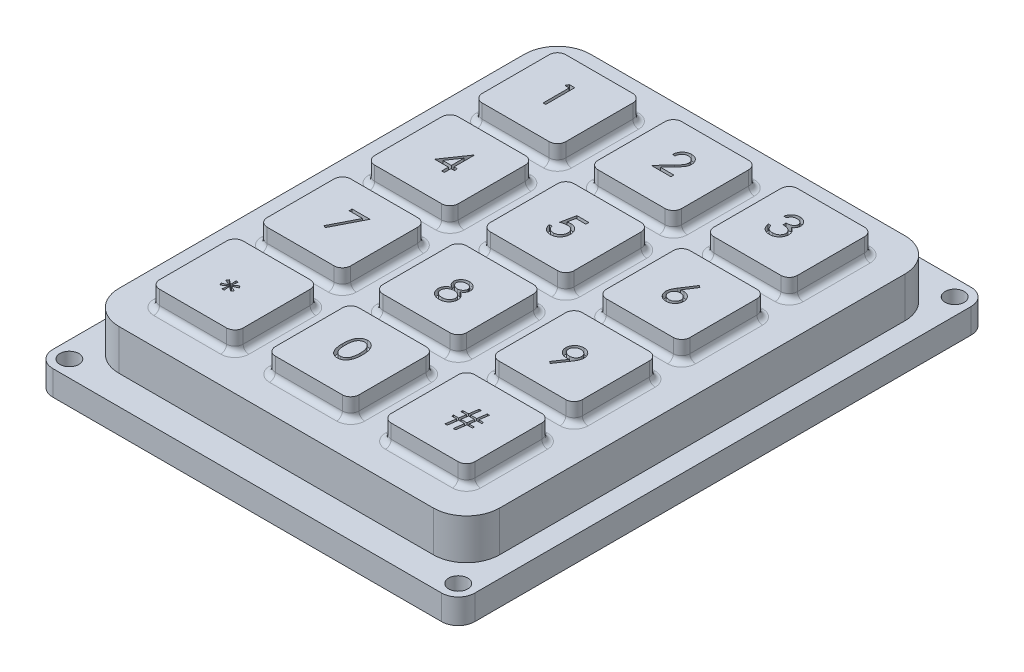
from build123d import *

# Parameters (mm, degrees)
BOSS_EXTRUDE1_DEPTH = 3
BOSS_EXTRUDE2_DEPTH = 4.9
SKETCH4_R           = 1.15
CUT_EXTRUDE1_DEPTH  = 42.209950255
BOSS_EXTRUDE4_DEPTH = 2.4
FILLET1_R           = 0.7
CUT_EXTRUDE2_DEPTH  = 42.563686073
FILLET2_R           = 2
CUT_EXTRUDE3_DEPTH  = 0.7


with BuildPart() as part:
    # Sketch1 → Boss-Extrude1 (new body)
    with BuildSketch(Plane(origin=(0, 0, 0), x_dir=(1, 0, 0), z_dir=(0, 1, 0))):
        with BuildLine():
            Line((23.5, -32), (-23.5, -32))
            ThreePointArc((-23.5, -32), (-24.914213562, -31.414213562), (-25.5, -30))
            Line((-25.5, -30), (-25.5, 30))
            ThreePointArc((-25.5, 30), (-24.914213562, 31.414213562), (-23.5, 32))
            Line((-23.5, 32), (23.5, 32))
            ThreePointArc((23.5, 32), (24.914213562, 31.414213562), (25.5, 30))
            Line((25.5, 30), (25.5, -30))
            ThreePointArc((25.5, -30), (24.914213562, -31.414213562), (23.5, -32))
        make_face()
    extrude(amount=BOSS_EXTRUDE1_DEPTH)

    # Sketch2 → Boss-Extrude2 (add)
    with BuildSketch(Plane(origin=(0, 3, 0), x_dir=(1, 0, 0), z_dir=(0, 1, 0))):
        with BuildLine():
            Line((-19, -28.5), (19, -28.5))
            ThreePointArc((19, -28.5), (21.828427125, -27.328427125), (23, -24.5))
            Line((23, -24.5), (23, 24.5))
            ThreePointArc((23, 24.5), (21.828427125, 27.328427125), (19, 28.5))
            Line((19, 28.5), (-19, 28.5))
            ThreePointArc((-19, 28.5), (-21.828427125, 27.328427125), (-23, 24.5))
            Line((-23, 24.5), (-23, -24.5))
            ThreePointArc((-23, -24.5), (-21.828427125, -27.328427125), (-19, -28.5))
        make_face()
    extrude(amount=BOSS_EXTRUDE2_DEPTH)

    # Sketch4 → Cut-Extrude1 (cut, through all)
    with BuildSketch(Plane(origin=(0, 3, 0), x_dir=(1, 0, 0), z_dir=(0, 1, 0))):
        with Locations(Location((-23.5, 30, 0), (0, 0, 270))):
            Circle(SKETCH4_R)
        with Locations(Location((-23.5, -30, 0), (0, 0, 90))):
            Circle(SKETCH4_R)
        with Locations(Location((23.5, -30, 0), (0, 0, 270))):
            Circle(SKETCH4_R)
        with Locations(Location((23.5, 30, 0), (0, 0, 90))):
            Circle(SKETCH4_R)
    extrude(amount=-CUT_EXTRUDE1_DEPTH, mode=Mode.SUBTRACT)

    # Sketch5 → Boss-Extrude4 (add)
    with BuildSketch(Plane(origin=(0, 7.9, 0), x_dir=(1, 0, 0), z_dir=(0, 1, 0))):
        with BuildLine():
            Line((-4.05, -24.55), (4.05, -24.55))
            ThreePointArc((4.05, -24.55), (4.757106781, -24.257106781), (5.05, -23.55))
            Line((5.05, -23.55), (5.05, -15.45))
            ThreePointArc((5.05, -15.45), (4.757106781, -14.742893219), (4.05, -14.45))
            Line((4.05, -14.45), (-4.05, -14.45))
            ThreePointArc((-4.05, -14.45), (-4.757106781, -14.742893219), (-5.05, -15.45))
            Line((-5.05, -15.45), (-5.05, -23.55))
            ThreePointArc((-5.05, -23.55), (-4.757106781, -24.257106781), (-4.05, -24.55))
        make_face()
        with BuildLine():
            Line((9.95, -24.55), (18.05, -24.55))
            ThreePointArc((18.05, -24.55), (18.757106781, -24.257106781), (19.05, -23.55))
            Line((19.05, -23.55), (19.05, -15.45))
            ThreePointArc((19.05, -15.45), (18.757106781, -14.742893219), (18.05, -14.45))
            Line((18.05, -14.45), (9.95, -14.45))
            ThreePointArc((9.95, -14.45), (9.242893219, -14.742893219), (8.95, -15.45))
            Line((8.95, -15.45), (8.95, -23.55))
            ThreePointArc((8.95, -23.55), (9.242893219, -24.257106781), (9.95, -24.55))
        make_face()
        with BuildLine():
            Line((-18.05, -24.55), (-9.95, -24.55))
            ThreePointArc((-9.95, -24.55), (-9.242893219, -24.257106781), (-8.95, -23.55))
            Line((-8.95, -23.55), (-8.95, -15.45))
            ThreePointArc((-8.95, -15.45), (-9.242893219, -14.742893219), (-9.95, -14.45))
            Line((-9.95, -14.45), (-18.05, -14.45))
            ThreePointArc((-18.05, -14.45), (-18.757106781, -14.742893219), (-19.05, -15.45))
            Line((-19.05, -15.45), (-19.05, -23.55))
            ThreePointArc((-19.05, -23.55), (-18.757106781, -24.257106781), (-18.05, -24.55))
        make_face()
        with BuildLine():
            Line((-4.05, -11.55), (4.05, -11.55))
            ThreePointArc((4.05, -11.55), (4.757106781, -11.257106781), (5.05, -10.55))
            Line((5.05, -10.55), (5.05, -2.45))
            ThreePointArc((5.05, -2.45), (4.757106781, -1.742893219), (4.05, -1.45))
            Line((4.05, -1.45), (-4.05, -1.45))
            ThreePointArc((-4.05, -1.45), (-4.757106781, -1.742893219), (-5.05, -2.45))
            Line((-5.05, -2.45), (-5.05, -10.55))
            ThreePointArc((-5.05, -10.55), (-4.757106781, -11.257106781), (-4.05, -11.55))
        make_face()
        with BuildLine():
            Line((9.95, -11.55), (18.05, -11.55))
            ThreePointArc((18.05, -11.55), (18.757106781, -11.257106781), (19.05, -10.55))
            Line((19.05, -10.55), (19.05, -2.45))
            ThreePointArc((19.05, -2.45), (18.757106781, -1.742893219), (18.05, -1.45))
            Line((18.05, -1.45), (9.95, -1.45))
            ThreePointArc((9.95, -1.45), (9.242893219, -1.742893219), (8.95, -2.45))
            Line((8.95, -2.45), (8.95, -10.55))
            ThreePointArc((8.95, -10.55), (9.242893219, -11.257106781), (9.95, -11.55))
        make_face()
        with BuildLine():
            Line((-18.05, -11.55), (-9.95, -11.55))
            ThreePointArc((-9.95, -11.55), (-9.242893219, -11.257106781), (-8.95, -10.55))
            Line((-8.95, -10.55), (-8.95, -2.45))
            ThreePointArc((-8.95, -2.45), (-9.242893219, -1.742893219), (-9.95, -1.45))
            Line((-9.95, -1.45), (-18.05, -1.45))
            ThreePointArc((-18.05, -1.45), (-18.757106781, -1.742893219), (-19.05, -2.45))
            Line((-19.05, -2.45), (-19.05, -10.55))
            ThreePointArc((-19.05, -10.55), (-18.757106781, -11.257106781), (-18.05, -11.55))
        make_face()
        with BuildLine():
            Line((-4.05, 1.45), (4.05, 1.45))
            ThreePointArc((4.05, 1.45), (4.757106781, 1.742893219), (5.05, 2.45))
            Line((5.05, 2.45), (5.05, 10.55))
            ThreePointArc((5.05, 10.55), (4.757106781, 11.257106781), (4.05, 11.55))
            Line((4.05, 11.55), (-4.05, 11.55))
            ThreePointArc((-4.05, 11.55), (-4.757106781, 11.257106781), (-5.05, 10.55))
            Line((-5.05, 10.55), (-5.05, 2.45))
            ThreePointArc((-5.05, 2.45), (-4.757106781, 1.742893219), (-4.05, 1.45))
        make_face()
        with BuildLine():
            Line((9.95, 1.45), (18.05, 1.45))
            ThreePointArc((18.05, 1.45), (18.757106781, 1.742893219), (19.05, 2.45))
            Line((19.05, 2.45), (19.05, 10.55))
            ThreePointArc((19.05, 10.55), (18.757106781, 11.257106781), (18.05, 11.55))
            Line((18.05, 11.55), (9.95, 11.55))
            ThreePointArc((9.95, 11.55), (9.242893219, 11.257106781), (8.95, 10.55))
            Line((8.95, 10.55), (8.95, 2.45))
            ThreePointArc((8.95, 2.45), (9.242893219, 1.742893219), (9.95, 1.45))
        make_face()
        with BuildLine():
            Line((-18.05, 1.45), (-9.95, 1.45))
            ThreePointArc((-9.95, 1.45), (-9.242893219, 1.742893219), (-8.95, 2.45))
            Line((-8.95, 2.45), (-8.95, 10.55))
            ThreePointArc((-8.95, 10.55), (-9.242893219, 11.257106781), (-9.95, 11.55))
            Line((-9.95, 11.55), (-18.05, 11.55))
            ThreePointArc((-18.05, 11.55), (-18.757106781, 11.257106781), (-19.05, 10.55))
            Line((-19.05, 10.55), (-19.05, 2.45))
            ThreePointArc((-19.05, 2.45), (-18.757106781, 1.742893219), (-18.05, 1.45))
        make_face()
        with BuildLine():
            Line((-4.05, 14.45), (4.05, 14.45))
            ThreePointArc((4.05, 14.45), (4.757106781, 14.742893219), (5.05, 15.45))
            Line((5.05, 15.45), (5.05, 23.55))
            ThreePointArc((5.05, 23.55), (4.757106781, 24.257106781), (4.05, 24.55))
            Line((4.05, 24.55), (-4.05, 24.55))
            ThreePointArc((-4.05, 24.55), (-4.757106781, 24.257106781), (-5.05, 23.55))
            Line((-5.05, 23.55), (-5.05, 15.45))
            ThreePointArc((-5.05, 15.45), (-4.757106781, 14.742893219), (-4.05, 14.45))
        make_face()
        with BuildLine():
            Line((9.95, 14.45), (18.05, 14.45))
            ThreePointArc((18.05, 14.45), (18.757106781, 14.742893219), (19.05, 15.45))
            Line((19.05, 15.45), (19.05, 23.55))
            ThreePointArc((19.05, 23.55), (18.757106781, 24.257106781), (18.05, 24.55))
            Line((18.05, 24.55), (9.95, 24.55))
            ThreePointArc((9.95, 24.55), (9.242893219, 24.257106781), (8.95, 23.55))
            Line((8.95, 23.55), (8.95, 15.45))
            ThreePointArc((8.95, 15.45), (9.242893219, 14.742893219), (9.95, 14.45))
        make_face()
        with BuildLine():
            Line((-18.05, 14.45), (-9.95, 14.45))
            ThreePointArc((-9.95, 14.45), (-9.242893219, 14.742893219), (-8.95, 15.45))
            Line((-8.95, 15.45), (-8.95, 23.55))
            ThreePointArc((-8.95, 23.55), (-9.242893219, 24.257106781), (-9.95, 24.55))
            Line((-9.95, 24.55), (-18.05, 24.55))
            ThreePointArc((-18.05, 24.55), (-18.757106781, 24.257106781), (-19.05, 23.55))
            Line((-19.05, 23.55), (-19.05, 15.45))
            ThreePointArc((-19.05, 15.45), (-18.757106781, 14.742893219), (-18.05, 14.45))
        make_face()
    extrude(amount=BOSS_EXTRUDE4_DEPTH)

    # Fillet1
    fillet1_edges = [part.edges().sort_by_distance(p)[0] for p in [
        (18.757106781, 7.9, 24.257106781),
        (19.05, 7.9, 19.5),
        (18.757106781, 7.9, 14.742893219),
        (14, 7.9, 14.45),
        (9.242893219, 7.9, 14.742893219),
        (8.95, 7.9, 19.5),
        (9.242893219, 7.9, 24.257106781),
        (14, 7.9, 24.55),
        (4.757106781, 7.9, 11.257106781),
        (5.05, 7.9, 6.5),
        (4.757106781, 7.9, 1.742893219),
        (0, 7.9, 1.45),
        (-4.757106781, 7.9, 1.742893219),
        (-5.05, 7.9, 6.5),
        (-4.757106781, 7.9, 11.257106781),
        (0, 7.9, 11.55),
        (-9.242893219, 7.9, 11.257106781),
        (-8.95, 7.9, 6.5),
        (-9.242893219, 7.9, 1.742893219),
        (-14, 7.9, 1.45),
        (-18.757106781, 7.9, 1.742893219),
        (-19.05, 7.9, 6.5),
        (-18.757106781, 7.9, 11.257106781),
        (-14, 7.9, 11.55),
        (18.757106781, 7.9, 11.257106781),
        (19.05, 7.9, 6.5),
        (18.757106781, 7.9, 1.742893219),
        (14, 7.9, 1.45),
        (9.242893219, 7.9, 1.742893219),
        (8.95, 7.9, 6.5),
        (9.242893219, 7.9, 11.257106781),
        (14, 7.9, 11.55),
        (4.757106781, 7.9, -1.742893219),
        (5.05, 7.9, -6.5),
        (4.757106781, 7.9, -11.257106781),
        (0, 7.9, -11.55),
        (-4.757106781, 7.9, -11.257106781),
        (-5.05, 7.9, -6.5),
        (-4.757106781, 7.9, -1.742893219),
        (0, 7.9, -1.45),
        (-9.242893219, 7.9, -1.742893219),
        (-8.95, 7.9, -6.5),
        (-9.242893219, 7.9, -11.257106781),
        (-14, 7.9, -11.55),
        (-18.757106781, 7.9, -11.257106781),
        (-19.05, 7.9, -6.5),
        (-18.757106781, 7.9, -1.742893219),
        (-14, 7.9, -1.45),
        (18.757106781, 7.9, -1.742893219),
        (19.05, 7.9, -6.5),
        (18.757106781, 7.9, -11.257106781),
        (14, 7.9, -11.55),
        (9.242893219, 7.9, -11.257106781),
        (8.95, 7.9, -6.5),
        (9.242893219, 7.9, -1.742893219),
        (14, 7.9, -1.45),
        (4.757106781, 7.9, -14.742893219),
        (5.05, 7.9, -19.5),
        (4.757106781, 7.9, -24.257106781),
        (0, 7.9, -24.55),
        (-4.757106781, 7.9, -24.257106781),
        (-5.05, 7.9, -19.5),
        (-4.757106781, 7.9, -14.742893219),
        (0, 7.9, -14.45),
        (-9.242893219, 7.9, -14.742893219),
        (-8.95, 7.9, -19.5),
        (-9.242893219, 7.9, -24.257106781),
        (-14, 7.9, -24.55),
        (-18.757106781, 7.9, -24.257106781),
        (-19.05, 7.9, -19.5),
        (-18.757106781, 7.9, -14.742893219),
        (-14, 7.9, -14.45),
        (18.757106781, 7.9, -14.742893219),
        (19.05, 7.9, -19.5),
        (18.757106781, 7.9, -24.257106781),
        (14, 7.9, -24.55),
        (9.242893219, 7.9, -24.257106781),
        (8.95, 7.9, -19.5),
        (9.242893219, 7.9, -14.742893219),
        (14, 7.9, -14.45),
        (4.757106781, 7.9, 24.257106781),
        (5.05, 7.9, 19.5),
        (4.757106781, 7.9, 14.742893219),
        (0, 7.9, 14.45),
        (-4.757106781, 7.9, 14.742893219),
        (-5.05, 7.9, 19.5),
        (-4.757106781, 7.9, 24.257106781),
        (0, 7.9, 24.55),
        (-9.242893219, 7.9, 24.257106781),
        (-8.95, 7.9, 19.5),
        (-9.242893219, 7.9, 14.742893219),
        (-14, 7.9, 14.45),
        (-18.757106781, 7.9, 14.742893219),
        (-19.05, 7.9, 19.5),
        (-18.757106781, 7.9, 24.257106781),
        (-14, 7.9, 24.55),
    ]]
    fillet(fillet1_edges, radius=FILLET1_R)

    # Sketch6 → Cut-Extrude2 (cut, through all)
    with BuildSketch(Plane(origin=(0, 3, 0), x_dir=(1, 0, 0), z_dir=(0, 1, 0))):
        Polygon((-3, 32), (-3, 28.820730597), (3, 28.820730597), (3, 32), (0, 37.955310805), align=None)
    extrude(amount=-CUT_EXTRUDE2_DEPTH, mode=Mode.SUBTRACT)

    # Fillet2
    fillet2_edges = [part.edges().sort_by_distance(p)[0] for p in [
        (3, 1.5, -28.820730597),
        (-3, 1.5, -28.820730597),
    ]]
    fillet(fillet2_edges, radius=FILLET2_R)

    # Sketch7 → Cut-Extrude3 (cut)
    # profile 1 of 12: a face of its own
    with BuildSketch(Plane(origin=(0, 10.3, 0), x_dir=(1, 0, 0), z_dir=(0, 1, 0))):
        Polygon((-14.700628475, 21.631365532), (-14.053493058, 21.631365532), (-14.053493058, 18.131365532), (-14.367595622, 18.131365532), (-14.367595622, 21.272391174), (-14.906057161, 21.272391174), align=None)
    # profile 2 of 12: a face of its own
    with BuildSketch(Plane(origin=(0, 10.3, 0), x_dir=(1, 0, 0), z_dir=(0, 1, 0))):
        with BuildLine():
            Line((-0.846543631, 20.554442456), (-1.160646195, 20.554442456))
            add(Edge.make_bspline(
                [(-1.160646195, 20.554442456), (-1.158599042, 20.596113343), (-1.154578488, 20.677953858), (-1.135750199, 20.797277764), (-1.108809321, 20.911332563), (-1.070717867, 21.019202477), (-1.02341159, 21.121841284), (-0.966681562, 21.2188413), (-0.899487712, 21.309832489), (-0.823280978, 21.393971332), (-0.740512339, 21.471158903), (-0.651206399, 21.537814146), (-0.557361372, 21.594131817), (-0.459261973, 21.641213059), (-0.355801409, 21.676552905), (-0.247918551, 21.702774544), (-0.135139415, 21.71855089), (-0.058299393, 21.720246676), (-0.019219913, 21.721109122)],
                knots=[0, 0, 0, 0, 1.10065271, 2.161652631, 3.183658789, 4.190468796, 5.17591951, 6.163126047, 7.15150782, 8.156236427, 9.156009102, 10.134482811, 11.092018607, 12.041330605, 13.001268258, 13.972401359, 14.968799086, 16, 16, 16, 16], degree=3))
            add(Edge.make_bspline(
                [(-0.019219913, 21.721109122), (0.019158161, 21.720210666), (0.094569706, 21.718445231), (0.20463172, 21.703284202), (0.309409015, 21.67953861), (0.408696781, 21.646223194), (0.501702846, 21.601438766), (0.58912589, 21.547641228), (0.672006701, 21.485421396), (0.746613485, 21.412167583), (0.815121564, 21.333965198), (0.874223819, 21.250477295), (0.924836983, 21.164248009), (0.967024663, 21.074619808), (0.998080802, 20.980748779), (1.02165901, 20.884001576), (1.034986423, 20.783376765), (1.037031847, 20.71527021), (1.038071754, 20.680644379)],
                knots=[0, 0, 0, 0, 1.111607364, 2.184268762, 3.212621178, 4.221274766, 5.211760367, 6.196651075, 7.1921475, 8.207485113, 9.220403448, 10.201281604, 11.166441695, 12.114753415, 13.065576456, 14.026450734, 14.996634279, 16, 16, 16, 16], degree=3))
            add(Edge.make_bspline(
                [(1.038071754, 20.680644379), (1.036378491, 20.631896544), (1.03302168, 20.53525633), (1.004307303, 20.393241468), (0.959460792, 20.255648049), (0.905463435, 20.144910746), (0.850990991, 20.055677253), (0.801903483, 19.982208548), (0.744438672, 19.903103079), (0.677760174, 19.818625742), (0.603247302, 19.728114837), (0.520225139, 19.631625042), (0.428101657, 19.530153272), (0.363443156, 19.46084767), (0.329938741, 19.424935244)],
                knots=[0, 0, 0, 0, 1.184426356, 2.348067706, 3.509069118, 4.696110526, 5.333549288, 6.050745305, 6.844228056, 7.710549037, 8.667450064, 9.695053472, 10.805634456, 12, 12, 12, 12], degree=3))
            Line((0.329938741, 19.424935244), (-0.545762381, 18.490339891))
            Line((-0.545762381, 18.490339891), (1.082943549, 18.490339891))
            Line((1.082943549, 18.490339891), (1.082943549, 18.131365532))
            Line((1.082943549, 18.131365532), (-1.295261579, 18.131365532))
            Line((-1.295261579, 18.131365532), (0.062110215, 19.579883161))
            add(Edge.make_bspline(
                [(0.062110215, 19.579883161), (0.095158102, 19.614381467), (0.158636329, 19.680645654), (0.248418906, 19.777388614), (0.329057894, 19.867138155), (0.401075287, 19.949724703), (0.462908793, 20.026356271), (0.517781025, 20.094550975), (0.561746616, 20.157305425), (0.609462011, 20.230046039), (0.655675993, 20.318858356), (0.695388349, 20.427392045), (0.719603197, 20.539119298), (0.722508033, 20.614621335), (0.72396919, 20.652599507)],
                knots=[0, 0, 0, 0, 1.329631726, 2.553950428, 3.673215718, 4.687767853, 5.603093632, 6.413772471, 7.123043292, 7.734684054, 8.834405432, 9.900288307, 10.943827018, 12, 12, 12, 12], degree=3))
            add(Edge.make_bspline(
                [(0.72396919, 20.652599507), (0.723333447, 20.676480905), (0.722080521, 20.723546556), (0.711022824, 20.792552315), (0.694312318, 20.859117128), (0.67036706, 20.923445748), (0.63876032, 20.9848914), (0.60028694, 21.04352888), (0.555896876, 21.100217845), (0.504545607, 21.153371143), (0.448134087, 21.202052349), (0.388539838, 21.245176434), (0.325489733, 21.281215545), (0.259249611, 21.310759042), (0.190004142, 21.333934423), (0.117619397, 21.349993003), (0.04229538, 21.360075487), (-0.009138115, 21.361439658), (-0.035345714, 21.362134763)],
                knots=[0, 0, 0, 0, 0.991446411, 1.95395049, 2.89581595, 3.838931463, 4.798493298, 5.75982156, 6.748411868, 7.785213223, 8.824556874, 9.840280684, 10.836137867, 11.835679398, 12.848801643, 13.863922112, 14.911575587, 16, 16, 16, 16], degree=3))
            add(Edge.make_bspline(
                [(-0.035345714, 21.362134763), (-0.062716547, 21.361419731), (-0.116468343, 21.360015526), (-0.195387376, 21.350192862), (-0.270673154, 21.333247021), (-0.342515056, 21.310070347), (-0.411034642, 21.280611798), (-0.475898686, 21.243920053), (-0.536961576, 21.20013656), (-0.594338099, 21.150496004), (-0.647202078, 21.095228403), (-0.693648954, 21.03361844), (-0.734232968, 20.966791024), (-0.769642201, 20.894926474), (-0.798397892, 20.817372694), (-0.820371042, 20.734404989), (-0.837757889, 20.646383607), (-0.843566409, 20.585598523), (-0.846543631, 20.554442456)],
                knots=[0, 0, 0, 0, 1.031018746, 2.02475058, 2.990194455, 3.934040569, 4.864654155, 5.795059489, 6.735614925, 7.690564532, 8.649604399, 9.611025574, 10.590972636, 11.591080095, 12.624614302, 13.701020113, 14.821632451, 16, 16, 16, 16], degree=3))
        make_face()
    # profile 3 of 12: a face of its own
    with BuildSketch(Plane(origin=(0, 10.3, 0), x_dir=(1, 0, 0), z_dir=(0, 1, 0))):
        with BuildLine():
            Line((12.346677857, 20.823673225), (12.032575293, 20.823673225))
            add(Edge.make_bspline(
                [(12.032575293, 20.823673225), (12.041084844, 20.858905709), (12.057720319, 20.927782333), (12.092417893, 21.026189594), (12.130217148, 21.119313115), (12.175606252, 21.205409189), (12.225115007, 21.286208092), (12.281837728, 21.359877216), (12.343157451, 21.428290182), (12.4109824, 21.489003419), (12.482111062, 21.543981149), (12.557545681, 21.590856206), (12.635768575, 21.631180359), (12.717321708, 21.664400591), (12.80244788, 21.689426114), (12.890377503, 21.70758292), (12.981341003, 21.719374034), (13.043088594, 21.720524797), (13.07444228, 21.721109122)],
                knots=[0, 0, 0, 0, 1.162005537, 2.271625781, 3.343758855, 4.383309926, 5.390229558, 6.379919256, 7.361854164, 8.333198761, 9.295911338, 10.242430842, 11.177959212, 12.116337295, 13.062827104, 14.020064771, 14.994644689, 16, 16, 16, 16], degree=3))
            add(Edge.make_bspline(
                [(13.07444228, 21.721109122), (13.120125022, 21.719729892), (13.210494033, 21.717001517), (13.34325708, 21.69208708), (13.471283899, 21.652661948), (13.593173147, 21.598188221), (13.70639158, 21.531000907), (13.807127766, 21.45103617), (13.894016277, 21.359836869), (13.966910655, 21.259104305), (14.023985654, 21.151448795), (14.066072027, 21.040648638), (14.091693708, 20.926966667), (14.095014265, 20.850209388), (14.096677857, 20.811754154)],
                knots=[0, 0, 0, 0, 1.083050992, 2.142477498, 3.193116406, 4.255571735, 5.30263384, 6.308962982, 7.297363603, 8.282367274, 9.249857812, 10.179914175, 11.08814088, 12, 12, 12, 12], degree=3))
            add(Edge.make_bspline(
                [(14.096677857, 20.811754154), (14.095514266, 20.77474736), (14.093237299, 20.702330805), (14.073903593, 20.596609308), (14.04136733, 20.496967708), (13.996297568, 20.402986546), (13.937956018, 20.315261706), (13.867283321, 20.233595815), (13.783780659, 20.157626657), (13.720501721, 20.114107184), (13.687923851, 20.091702071)],
                knots=[0, 0, 0, 0, 1.024540389, 2.004866551, 2.965041327, 3.920577974, 4.882998113, 5.874504559, 6.905732034, 8, 8, 8, 8], degree=3))
            add(Edge.make_bspline(
                [(13.687923851, 20.091702071), (13.725155605, 20.073723899), (13.798922479, 20.038103942), (13.899473009, 19.968248184), (13.990750884, 19.887591837), (14.041654603, 19.824649184), (14.067230742, 19.793024186)],
                knots=[0, 0, 0, 0, 1.015518401, 2.012035669, 3.001164323, 4, 4, 4, 4], degree=3))
            add(Edge.make_bspline(
                [(14.067230742, 19.793024186), (14.084072084, 19.769966435), (14.11747898, 19.724228518), (14.158714514, 19.650692092), (14.196123628, 19.576340603), (14.225273847, 19.499181197), (14.247847714, 19.420108183), (14.263983746, 19.338985787), (14.274007887, 19.255747765), (14.275443439, 19.199435285), (14.276165036, 19.171129154)],
                knots=[0, 0, 0, 0, 1.025084078, 2.033381695, 3.024893161, 4.013698104, 4.991890475, 5.976764909, 6.982997093, 8, 8, 8, 8], degree=3))
            add(Edge.make_bspline(
                [(14.276165036, 19.171129154), (14.274370523, 19.122119433), (14.270789941, 19.024330631), (14.238785867, 18.87985591), (14.189172626, 18.738630407), (14.11871569, 18.603555568), (14.032848181, 18.477175187), (13.930690857, 18.364098878), (13.813404449, 18.266900274), (13.6825988, 18.185690046), (13.540881671, 18.120772123), (13.389306079, 18.075714681), (13.230056025, 18.046368681), (13.120848728, 18.043221812), (13.065327697, 18.041621943)],
                knots=[0, 0, 0, 0, 0.955779014, 1.907060117, 2.875433937, 3.871313158, 4.872415639, 5.851225146, 6.836215519, 7.83643374, 8.849228613, 9.86973379, 10.916971861, 12, 12, 12, 12], degree=3))
            add(Edge.make_bspline(
                [(13.065327697, 18.041621943), (13.027908396, 18.042490156), (12.954279691, 18.04419851), (12.846036193, 18.055877111), (12.742714494, 18.077207117), (12.644174896, 18.105910422), (12.550329859, 18.142302164), (12.461465754, 18.187620862), (12.377035861, 18.240932364), (12.29783691, 18.302865952), (12.223878342, 18.372147292), (12.157125618, 18.450006302), (12.096465825, 18.535003706), (12.043523186, 18.628126762), (11.995886233, 18.728172019), (11.956705277, 18.836420517), (11.922219708, 18.951904539), (11.906186244, 19.03238228), (11.897959908, 19.073673225)],
                knots=[0, 0, 0, 0, 1.048658725, 2.063410685, 3.046034179, 4.001477787, 4.936774919, 5.862367409, 6.792675028, 7.730719943, 8.675894397, 9.627829632, 10.600096036, 11.597688215, 12.626045268, 13.701542398, 14.82072376, 16, 16, 16, 16], degree=3))
            Line((11.897959908, 19.073673225), (12.212062472, 19.073673225))
            add(Edge.make_bspline(
                [(12.212062472, 19.073673225), (12.220245764, 19.046724212), (12.236162976, 18.99430604), (12.263257275, 18.918865734), (12.294125547, 18.849707681), (12.327240105, 18.786324559), (12.362018551, 18.728092157), (12.400933476, 18.676550288), (12.441102622, 18.629435085), (12.471381975, 18.602890473), (12.486201094, 18.589899186)],
                knots=[0, 0, 0, 0, 1.198163088, 2.33053128, 3.407730985, 4.417276592, 5.372219308, 6.28897303, 7.162600585, 8, 8, 8, 8], degree=3))
            add(Edge.make_bspline(
                [(12.486201094, 18.589899186), (12.505797671, 18.574790852), (12.544930334, 18.544620821), (12.608698565, 18.506119192), (12.675763451, 18.472758167), (12.747578125, 18.447274471), (12.822592895, 18.42569681), (12.902020261, 18.411576291), (12.985159478, 18.40188812), (13.041927241, 18.401033188), (13.070936671, 18.400596302)],
                knots=[0, 0, 0, 0, 0.946170439, 1.889420265, 2.845303464, 3.807233317, 4.801018734, 5.828864929, 6.890507805, 8, 8, 8, 8], degree=3))
            add(Edge.make_bspline(
                [(13.070936671, 18.400596302), (13.103690174, 18.401212207), (13.167736821, 18.402416557), (13.26119168, 18.413492263), (13.350099128, 18.429622677), (13.433472053, 18.45453566), (13.512402561, 18.485316511), (13.58578421, 18.523964917), (13.654580316, 18.569309638), (13.717909722, 18.620848797), (13.774855229, 18.677270292), (13.824994743, 18.736283363), (13.867619404, 18.797639193), (13.902002982, 18.861677313), (13.929153533, 18.928132542), (13.947636733, 18.997191372), (13.960488248, 19.068288638), (13.961534861, 19.116617607), (13.962062472, 19.140980917)],
                knots=[0, 0, 0, 0, 1.217147791, 2.380027433, 3.494444702, 4.572153297, 5.609568379, 6.639424714, 7.649109417, 8.668170816, 9.669597737, 10.625200337, 11.543417969, 12.441394052, 13.322311151, 14.205496177, 15.095365482, 16, 16, 16, 16], degree=3))
            add(Edge.make_bspline(
                [(13.962062472, 19.140980917), (13.960532171, 19.173592256), (13.957479182, 19.238652664), (13.934170603, 19.334370239), (13.895831739, 19.426593651), (13.842159227, 19.513749441), (13.776823499, 19.594525343), (13.700458592, 19.666596825), (13.612430364, 19.726066916), (13.531410494, 19.767155572), (13.459645338, 19.795192648), (13.398229954, 19.813867612), (13.32947335, 19.829681268), (13.254207001, 19.844393539), (13.171863785, 19.856914887), (13.082533347, 19.867356703), (12.986197585, 19.875711744), (12.919506419, 19.879442839), (12.885139395, 19.881365532)],
                knots=[0, 0, 0, 0, 1.07054697, 2.135767047, 3.216561865, 4.33974944, 5.486079747, 6.621378074, 7.775625952, 8.963672916, 9.598146892, 10.304877434, 11.070270905, 11.915000392, 12.823868403, 13.805723172, 14.86925407, 16, 16, 16, 16], degree=3))
            Line((12.885139395, 19.881365532), (12.885139395, 20.240339891))
            add(Edge.make_bspline(
                [(12.885139395, 20.240339891), (12.928440561, 20.241074695), (13.013256908, 20.242513995), (13.137151212, 20.259922006), (13.255624525, 20.284002634), (13.366051267, 20.320887826), (13.46669998, 20.363728123), (13.554019582, 20.413580332), (13.626786729, 20.468995082), (13.684647801, 20.530827691), (13.728177029, 20.597142738), (13.760003827, 20.666259396), (13.778804153, 20.738783457), (13.78131382, 20.788278125), (13.782575293, 20.813156398)],
                knots=[0, 0, 0, 0, 1.321986639, 2.589447074, 3.816329219, 5.01088745, 6.139805852, 7.153945165, 8.075214402, 8.924034688, 9.728124013, 10.488707548, 11.240355623, 12, 12, 12, 12], degree=3))
            add(Edge.make_bspline(
                [(13.782575293, 20.813156398), (13.782160882, 20.831434143), (13.781336431, 20.86779685), (13.770939153, 20.920921919), (13.755315112, 20.972422865), (13.733835383, 21.022080675), (13.705085184, 21.069550949), (13.670679198, 21.115238398), (13.629711097, 21.158882177), (13.58276565, 21.199562496), (13.532353845, 21.238331734), (13.47710407, 21.271245371), (13.418682196, 21.299390433), (13.357023541, 21.322599935), (13.29192801, 21.340059223), (13.223701453, 21.352595064), (13.152213769, 21.360432719), (13.103442037, 21.361561135), (13.078649011, 21.362134763)],
                knots=[0, 0, 0, 0, 0.884392785, 1.759457502, 2.611959086, 3.489218968, 4.37281399, 5.2945488, 6.255912374, 7.266815255, 8.301784654, 9.332968512, 10.37626691, 11.440494194, 12.520033166, 13.637162961, 14.798855837, 16, 16, 16, 16], degree=3))
            add(Edge.make_bspline(
                [(13.078649011, 21.362134763), (13.038797343, 21.360743401), (12.960957766, 21.358025748), (12.84874285, 21.334222734), (12.744423516, 21.296244651), (12.664684849, 21.250911631), (12.605802275, 21.206161197), (12.563725337, 21.167078811), (12.522404826, 21.123645987), (12.484559149, 21.073187612), (12.446285173, 21.019120822), (12.411440611, 20.95869714), (12.377580919, 20.893492746), (12.357178369, 20.847397112), (12.346677857, 20.823673225)],
                knots=[0, 0, 0, 0, 1.472543308, 2.876219568, 4.221790263, 5.565193594, 6.249813518, 6.953379497, 7.687249741, 8.463570142, 9.283606569, 10.136032583, 11.040678096, 12, 12, 12, 12], degree=3))
        make_face()
    # profile 4 of 12: a face of its own
    with BuildSketch(Plane(origin=(0, 10.3, 0), x_dir=(1, 0, 0), z_dir=(0, 1, 0))):
        Polygon((-13.1244245, 8.472003828), (-13.060622417, 8.472003828), (-13.060622417, 6.048926905), (-12.656776263, 6.048926905), (-12.656776263, 5.689952546), (-13.060622417, 5.689952546), (-13.060622417, 4.882260238), (-13.374724981, 4.882260238), (-13.374724981, 5.689952546), (-15.034981391, 5.689952546), align=None)
        Polygon((-13.374724981, 6.048926905), (-13.374724981, 7.568958956), (-14.417994212, 6.048926905), align=None, mode=Mode.SUBTRACT)
    # profile 5 of 12: a face of its own
    with BuildSketch(Plane(origin=(0, 10.3, 0), x_dir=(1, 0, 0), z_dir=(0, 1, 0))):
        with BuildLine():
            Line((0.903456369, 8.382260238), (0.903456369, 8.023285879))
            Line((0.903456369, 8.023285879), (-0.287048438, 8.023285879))
            Line((-0.287048438, 8.023285879), (-0.475650201, 7.102712963))
            add(Edge.make_bspline(
                [(-0.475650201, 7.102712963), (-0.438594327, 7.112943235), (-0.366804431, 7.132762768), (-0.26084457, 7.154768539), (-0.160252367, 7.168033983), (-0.094976996, 7.169845293), (-0.063390586, 7.170721777)],
                knots=[0, 0, 0, 0, 1.100273476, 2.13160584, 3.095893838, 4, 4, 4, 4], degree=3))
            add(Edge.make_bspline(
                [(-0.063390586, 7.170721777), (-0.024306846, 7.169875841), (0.052541551, 7.16821252), (0.164980498, 7.152240671), (0.272313391, 7.127100756), (0.374315762, 7.091980234), (0.471176312, 7.047070501), (0.562003874, 6.990970561), (0.648161787, 6.92543723), (0.728104381, 6.850092218), (0.800628689, 6.767170601), (0.864394678, 6.67801273), (0.918557269, 6.583485068), (0.962118024, 6.482684459), (0.996902358, 6.376725306), (1.020054353, 6.264492723), (1.035471062, 6.147044603), (1.037193448, 6.066740033), (1.038071754, 6.025789886)],
                knots=[0, 0, 0, 0, 1.052922333, 2.070308379, 3.05430497, 4.020497103, 4.973039431, 5.925935799, 6.892292201, 7.88610001, 8.88166317, 9.857072816, 10.836096531, 11.812156883, 12.81219415, 13.836441305, 14.89672472, 16, 16, 16, 16], degree=3))
            add(Edge.make_bspline(
                [(1.038071754, 6.025789886), (1.037406679, 5.997267665), (1.036085516, 5.940608678), (1.029366928, 5.856464477), (1.016431212, 5.774101644), (0.999063488, 5.693509252), (0.97652107, 5.61483988), (0.949232016, 5.537868352), (0.915835989, 5.463073745), (0.879204613, 5.38974835), (0.837958135, 5.319549843), (0.792179628, 5.253900857), (0.743814137, 5.191816575), (0.691772751, 5.133962842), (0.635571756, 5.080719824), (0.575891789, 5.031771543), (0.51320907, 4.986290212), (0.446553828, 4.946122017), (0.377411345, 4.909159061), (0.304783128, 4.878835524), (0.230322428, 4.851724996), (0.152957552, 4.830115468), (0.072863739, 4.813182914), (-0.010091036, 4.801682313), (-0.095471706, 4.793305875), (-0.153346719, 4.792781519), (-0.182581291, 4.792516649)],
                knots=[0, 0, 0, 0, 1.056347294, 2.098418968, 3.122841568, 4.141288669, 5.149314143, 6.15115421, 7.162517403, 8.180376062, 9.185164535, 10.17417709, 11.141909838, 12.097768115, 13.052685741, 14.0056014, 14.954263652, 15.917497458, 16.885230207, 17.854509472, 18.828990115, 19.81800267, 20.826176721, 21.857883937, 22.917946725, 24, 24, 24, 24], degree=3))
            add(Edge.make_bspline(
                [(-0.182581291, 4.792516649), (-0.217455472, 4.793207487), (-0.286066302, 4.794566629), (-0.386586869, 4.808785114), (-0.483301475, 4.82914903), (-0.575431576, 4.8597853), (-0.66380284, 4.898172595), (-0.747225558, 4.946688766), (-0.827831334, 5.00166787), (-0.902343371, 5.066548223), (-0.971499484, 5.137463905), (-1.033405993, 5.214421546), (-1.08853957, 5.296150988), (-1.136017317, 5.383049142), (-1.176515338, 5.474887673), (-1.208330326, 5.572010674), (-1.234008681, 5.673910678), (-1.244872102, 5.744064189), (-1.250389785, 5.779696136)],
                knots=[0, 0, 0, 0, 1.0467383, 2.05933395, 3.04377827, 4.011590433, 4.970194871, 5.932262533, 6.905835911, 7.896367577, 8.894135286, 9.877477877, 10.858688626, 11.851381753, 12.8477658, 13.868841284, 14.917554742, 16, 16, 16, 16], degree=3))
            Line((-1.250389785, 5.779696136), (-0.936287221, 5.779696136))
            add(Edge.make_bspline(
                [(-0.936287221, 5.779696136), (-0.928558663, 5.746319683), (-0.913703947, 5.682168288), (-0.881098198, 5.592036947), (-0.841232322, 5.511717723), (-0.793827974, 5.44014814), (-0.737277944, 5.377739143), (-0.672748515, 5.322122081), (-0.600400791, 5.271946952), (-0.520007562, 5.230124184), (-0.435194483, 5.194455431), (-0.346427273, 5.170703736), (-0.256122926, 5.154002843), (-0.195044556, 5.152331082), (-0.164352124, 5.151491008)],
                knots=[0, 0, 0, 0, 1.136247022, 2.183929868, 3.172523383, 4.106158343, 5.02341133, 5.958108904, 6.928429099, 7.938127109, 8.96079061, 9.975095812, 10.982467395, 12, 12, 12, 12], degree=3))
            add(Edge.make_bspline(
                [(-0.164352124, 5.151491008), (-0.13439368, 5.152311785), (-0.075405258, 5.153927904), (0.011406129, 5.166366916), (0.095219003, 5.185524487), (0.17520636, 5.214194342), (0.252767899, 5.249039061), (0.32594167, 5.293754137), (0.396844547, 5.345214155), (0.463272681, 5.404170785), (0.52411213, 5.46914048), (0.577868251, 5.538617873), (0.622645164, 5.61273472), (0.660379273, 5.690207872), (0.689032572, 5.77188643), (0.709473553, 5.857387605), (0.721476612, 5.946922585), (0.723127792, 6.007991895), (0.72396919, 6.0391112)],
                knots=[0, 0, 0, 0, 1.027316725, 2.022795036, 3.002884548, 3.971462791, 4.93288096, 5.914575861, 6.907176829, 7.935150275, 8.956128384, 9.956726525, 10.942570165, 11.921478529, 12.907843606, 13.90538589, 14.932640048, 16, 16, 16, 16], degree=3))
            add(Edge.make_bspline(
                [(0.72396919, 6.0391112), (0.72331071, 6.067186952), (0.72202183, 6.122141241), (0.71149126, 6.202540447), (0.693174288, 6.278613489), (0.667750408, 6.350727723), (0.6354709, 6.418951166), (0.596024588, 6.483354226), (0.54867119, 6.543088059), (0.494579301, 6.598180613), (0.43532126, 6.649025488), (0.369877518, 6.692369574), (0.299617591, 6.728833492), (0.225387991, 6.76030149), (0.145423093, 6.782902235), (0.06130646, 6.799870121), (-0.027870247, 6.809685483), (-0.088840936, 6.811047372), (-0.120181451, 6.811747418)],
                knots=[0, 0, 0, 0, 1.045622112, 2.046656509, 3.013763289, 3.955457236, 4.890082067, 5.820317437, 6.762574623, 7.722996705, 8.69280354, 9.665887285, 10.63943826, 11.638615906, 12.663482002, 13.728887084, 14.832589034, 16, 16, 16, 16], degree=3))
            add(Edge.make_bspline(
                [(-0.120181451, 6.811747418), (-0.14731038, 6.811166827), (-0.203324735, 6.809968053), (-0.289247562, 6.801141556), (-0.379539285, 6.786902262), (-0.473853781, 6.767316015), (-0.572474289, 6.741684938), (-0.67519269, 6.710970437), (-0.782224956, 6.674248438), (-0.85434268, 6.646516225), (-0.891415426, 6.632260238)],
                knots=[0, 0, 0, 0, 0.817624296, 1.688186739, 2.600797293, 3.572016777, 4.590301741, 5.671205678, 6.80286297, 8, 8, 8, 8], degree=3))
            Line((-0.891415426, 6.632260238), (-0.532441067, 8.382260238))
            Line((-0.532441067, 8.382260238), (0.903456369, 8.382260238))
        make_face()
    # profile 6 of 12: a face of its own
    with BuildSketch(Plane(origin=(0, 10.3, 0), x_dir=(1, 0, 0), z_dir=(0, 1, 0))):
        with BuildLine():
            Line((14.184095718, 8.472003828), (14.425982737, 8.281999822))
            Line((14.425982737, 8.281999822), (13.50120309, 6.867837161))
            add(Edge.make_bspline(
                [(13.50120309, 6.867837161), (13.562773367, 6.877651022), (13.682873153, 6.896794067), (13.804439052, 6.899952012), (13.863683058, 6.901491008)],
                knots=[0, 0, 0, 0, 1.025318673, 2, 2, 2, 2], degree=3))
            add(Edge.make_bspline(
                [(13.863683058, 6.901491008), (13.899255554, 6.900534896), (13.969278954, 6.898652818), (14.072085757, 6.884168968), (14.170874693, 6.861343856), (14.265236305, 6.8280716), (14.355509287, 6.785569246), (14.442211683, 6.734630375), (14.523713693, 6.672624695), (14.601064872, 6.603359739), (14.67129197, 6.526642755), (14.733468025, 6.445241418), (14.785694817, 6.359240537), (14.828068738, 6.268683671), (14.860973617, 6.173710411), (14.884961262, 6.074442272), (14.899140855, 5.9708108), (14.901066346, 5.900332625), (14.902044436, 5.864531873)],
                knots=[0, 0, 0, 0, 1.04369286, 2.054478336, 3.041073146, 4.015093852, 4.984733326, 5.965804835, 6.960378782, 7.985147595, 9.009457201, 10.008161701, 10.986880575, 11.956520048, 12.937015923, 13.931873656, 14.949455224, 16, 16, 16, 16], degree=3))
            add(Edge.make_bspline(
                [(14.902044436, 5.864531873), (14.900621331, 5.815552169), (14.897820997, 5.719171703), (14.869917201, 5.578794997), (14.826557557, 5.445062481), (14.764580028, 5.32010931), (14.687597645, 5.20410674), (14.593720053, 5.101321275), (14.486276564, 5.009651237), (14.364789766, 4.932994618), (14.234046802, 4.870391567), (14.096694804, 4.825426325), (13.954067658, 4.797742856), (13.85726305, 4.794272253), (13.808294436, 4.792516649)],
                knots=[0, 0, 0, 0, 1.031375318, 2.029502543, 3.004789286, 3.987476834, 4.960371455, 5.9300674, 6.912260825, 7.929083631, 8.949397511, 9.960523116, 10.96833055, 12, 12, 12, 12], degree=3))
            add(Edge.make_bspline(
                [(13.808294436, 4.792516649), (13.761197735, 4.794044854), (13.667907417, 4.797071962), (13.530674623, 4.8240379), (13.398811606, 4.867745003), (13.273242225, 4.927959282), (13.156921612, 5.004017164), (13.052855975, 5.095579444), (12.961564201, 5.200688909), (12.88558958, 5.319329256), (12.825330848, 5.446819213), (12.780140923, 5.57975637), (12.75374468, 5.717656352), (12.750056123, 5.811137491), (12.748198282, 5.858221777)],
                knots=[0, 0, 0, 0, 1.012016664, 2.004627821, 2.994792927, 3.992885782, 4.990978636, 5.973936114, 6.964471063, 7.975201453, 8.993600317, 9.990122807, 10.98767138, 12, 12, 12, 12], degree=3))
            add(Edge.make_bspline(
                [(12.748198282, 5.858221777), (12.749379727, 5.89426636), (12.751792012, 5.967862512), (12.768635402, 6.07932654), (12.795700197, 6.193377622), (12.826010443, 6.290131815), (12.858036054, 6.369393337), (12.884688593, 6.433296828), (12.917862589, 6.499057901), (12.95323597, 6.568931537), (12.993992839, 6.64111697), (13.038308489, 6.716820639), (13.08740814, 6.794838567), (13.121828302, 6.847782762), (13.139424244, 6.874848379)],
                knots=[0, 0, 0, 0, 1.173818275, 2.396712641, 3.66331629, 4.989737886, 5.693666774, 6.447286557, 7.243889047, 8.091586357, 8.998013824, 9.943181721, 10.948533338, 12, 12, 12, 12], degree=3))
            Line((13.139424244, 6.874848379), (14.184095718, 8.472003828))
        make_face()
        with BuildLine():
            add(Edge.make_bspline(
                [(13.797777609, 6.542516649), (13.771115364, 6.541738605), (13.719036255, 6.54021886), (13.64262884, 6.531393608), (13.570315589, 6.514774542), (13.501138455, 6.49360821), (13.436390752, 6.46450515), (13.375601912, 6.429153351), (13.31853686, 6.387532173), (13.265793309, 6.340231262), (13.217973645, 6.288443229), (13.176792514, 6.232973707), (13.141270114, 6.175159504), (13.112388295, 6.114517562), (13.08989822, 6.051071062), (13.073629969, 5.985111813), (13.064576218, 5.916197507), (13.063069986, 5.869465004), (13.062300846, 5.845601585)],
                knots=[0, 0, 0, 0, 1.129588631, 2.206414736, 3.251139165, 4.268635594, 5.265702196, 6.250456724, 7.242448911, 8.251968645, 9.246821453, 10.222880186, 11.173611482, 12.116736599, 13.062300278, 14.020270554, 14.989073742, 16, 16, 16, 16], degree=3))
            add(Edge.make_bspline(
                [(13.062300846, 5.845601585), (13.062927208, 5.821951605), (13.064155409, 5.775577515), (13.075307729, 5.707238335), (13.092342811, 5.641473427), (13.117683207, 5.578621828), (13.147910095, 5.51772551), (13.18781542, 5.460990225), (13.232032205, 5.404970155), (13.284886139, 5.353968683), (13.341609502, 5.306512059), (13.402210704, 5.265031805), (13.465370664, 5.229545632), (13.531942086, 5.201734534), (13.60098047, 5.178910248), (13.673061024, 5.162848768), (13.74823388, 5.153768242), (13.799155818, 5.152260049), (13.825121359, 5.151491008)],
                knots=[0, 0, 0, 0, 0.989467248, 1.94019797, 2.891935182, 3.827694429, 4.772920941, 5.730924762, 6.725747692, 7.756678648, 8.79901574, 9.819492441, 10.826891316, 11.826466727, 12.835195252, 13.867842842, 14.912794438, 16, 16, 16, 16], degree=3))
            add(Edge.make_bspline(
                [(13.825121359, 5.151491008), (13.851086857, 5.152260109), (13.902008712, 5.153768421), (13.977182172, 5.16284809), (14.049260491, 5.178912738), (14.118307, 5.201725508), (14.184848431, 5.229579117), (14.247953152, 5.264811037), (14.307981246, 5.306767155), (14.364741845, 5.353887583), (14.417375784, 5.405260435), (14.462653062, 5.460490158), (14.501336296, 5.518184053), (14.532770483, 5.578381943), (14.557831774, 5.64151143), (14.574953241, 5.707228154), (14.58608253, 5.77558018), (14.587313896, 5.821952505), (14.587941872, 5.845601585)],
                knots=[0, 0, 0, 0, 1.087397944, 2.132534446, 3.165364764, 4.174271784, 5.174024072, 6.181601208, 7.194203697, 8.236725232, 9.267838612, 10.269026844, 11.221737037, 12.171628256, 13.107553087, 14.05945871, 15.010357665, 16, 16, 16, 16], degree=3))
            add(Edge.make_bspline(
                [(14.587941872, 5.845601585), (14.587391579, 5.869496135), (14.586311533, 5.916393368), (14.574095584, 5.985080986), (14.55715321, 6.051406192), (14.531570179, 6.114952141), (14.498333635, 6.175468069), (14.457850228, 6.23325967), (14.411017657, 6.288770017), (14.356920118, 6.340332825), (14.298029884, 6.387479903), (14.235414298, 6.42909946), (14.169906325, 6.464224436), (14.101572382, 6.493531539), (14.0296295, 6.514681013), (13.95523916, 6.531334256), (13.877449918, 6.540196273), (13.82467331, 6.541733339), (13.797777609, 6.542516649)],
                knots=[0, 0, 0, 0, 0.978206639, 1.919901502, 2.851605144, 3.780102724, 4.718870031, 5.675451981, 6.667674623, 7.690630536, 8.733308323, 9.756129687, 10.767539656, 11.776269907, 12.797430371, 13.836405707, 14.897401972, 16, 16, 16, 16], degree=3))
        make_face(mode=Mode.SUBTRACT)
    # profile 7 of 12: a face of its own
    with BuildSketch(Plane(origin=(0, 10.3, 0), x_dir=(1, 0, 0), z_dir=(0, 1, 0))):
        Polygon((-14.810622417, -4.513836991), (-12.656776263, -4.513836991), (-14.496519853, -8.103580581), (-14.767853987, -7.954241639), (-13.188226584, -4.87281135), (-14.810622417, -4.87281135), align=None)
    # profile 8 of 12: a face of its own
    with BuildSketch(Plane(origin=(0, 10.3, 0), x_dir=(1, 0, 0), z_dir=(0, 1, 0))):
        with BuildLine():
            add(Edge.make_bspline(
                [(0.406361017, -6.67115332), (0.435009564, -6.686091276), (0.490883798, -6.715225278), (0.570461007, -6.762136106), (0.643186008, -6.811577071), (0.71107657, -6.86121293), (0.77293992, -6.912944582), (0.828084333, -6.966977738), (0.877871953, -7.021963683), (0.921298737, -7.078833523), (0.959495574, -7.137436173), (0.992507709, -7.197925446), (1.020724912, -7.260168779), (1.043087851, -7.324845609), (1.061509642, -7.391005871), (1.074185247, -7.459503853), (1.081002165, -7.529888194), (1.082290979, -7.577456495), (1.082943549, -7.601541941)],
                knots=[0, 0, 0, 0, 1.272397273, 2.481599622, 3.635517121, 4.734568067, 5.792894095, 6.808321871, 7.773003508, 8.711915296, 9.623354172, 10.525449501, 11.423591555, 12.311487226, 13.218079475, 14.126165749, 15.051214107, 16, 16, 16, 16], degree=3))
            add(Edge.make_bspline(
                [(1.082943549, -7.601541941), (1.082172128, -7.635239674), (1.080645197, -7.701940131), (1.067345213, -7.800386242), (1.047432235, -7.895998024), (1.018352723, -7.988754515), (0.980639332, -8.078143888), (0.934162496, -8.164242662), (0.881551291, -8.248461971), (0.839299052, -8.300281373), (0.81791951, -8.326501877)],
                knots=[0, 0, 0, 0, 1.025265484, 2.029385089, 3.018602448, 3.995076438, 4.983346944, 5.966715145, 6.97116228, 8, 8, 8, 8], degree=3))
            add(Edge.make_bspline(
                [(0.81791951, -8.326501877), (0.790083036, -8.357095651), (0.73475407, -8.417905144), (0.639971143, -8.496855954), (0.535949259, -8.563205348), (0.423090926, -8.617277243), (0.301697825, -8.659363102), (0.17179582, -8.68960562), (0.033131667, -8.706928049), (-0.062173804, -8.709432038), (-0.111066868, -8.710716621)],
                knots=[0, 0, 0, 0, 0.954267603, 1.896743057, 2.838368354, 3.796610408, 4.779680527, 5.799409237, 6.871065594, 8, 8, 8, 8], degree=3))
            add(Edge.make_bspline(
                [(-0.111066868, -8.710716621), (-0.158080257, -8.709564143), (-0.249563536, -8.707321538), (-0.382721413, -8.692127106), (-0.506844483, -8.66549924), (-0.622654451, -8.62905463), (-0.729453145, -8.581644402), (-0.826936246, -8.522635993), (-0.916510218, -8.454404551), (-0.995456692, -8.374990473), (-1.065545135, -8.289932601), (-1.127113188, -8.202180991), (-1.178287267, -8.111727633), (-1.221614362, -8.019921266), (-1.254782385, -7.925475112), (-1.277754595, -7.828875099), (-1.292343909, -7.730289956), (-1.294285044, -7.663758303), (-1.295261579, -7.630287935)],
                knots=[0, 0, 0, 0, 1.256902934, 2.445805442, 3.576955095, 4.645999104, 5.686449165, 6.692658513, 7.68621702, 8.689161843, 9.678783111, 10.630372946, 11.551080876, 12.453998257, 13.34127905, 14.221779781, 15.105423033, 16, 16, 16, 16], degree=3))
            add(Edge.make_bspline(
                [(-1.295261579, -7.630287935), (-1.294683698, -7.605728743), (-1.293541602, -7.557191111), (-1.285636753, -7.485481783), (-1.272928292, -7.415685648), (-1.255668835, -7.347544904), (-1.232277809, -7.281555632), (-1.204035676, -7.217405158), (-1.171103723, -7.155021059), (-1.133022558, -7.094062178), (-1.088720534, -7.035382666), (-1.038556884, -6.977986671), (-0.981529016, -6.922764804), (-0.918271357, -6.869042379), (-0.849506817, -6.815866405), (-0.773449287, -6.766110677), (-0.692115019, -6.716252712), (-0.634309613, -6.686444387), (-0.604656612, -6.67115332)],
                knots=[0, 0, 0, 0, 0.941657376, 1.861047343, 2.762797495, 3.66048619, 4.553285746, 5.444104102, 6.34607688, 7.256116206, 8.197091036, 9.162375105, 10.176350973, 11.237807142, 12.343728897, 13.50695164, 14.721116704, 16, 16, 16, 16], degree=3))
            add(Edge.make_bspline(
                [(-0.604656612, -6.67115332), (-0.645247986, -6.649018551), (-0.723844249, -6.606159443), (-0.82791369, -6.527412637), (-0.917304314, -6.442124822), (-0.989559031, -6.348495028), (-1.046431259, -6.249448153), (-1.085449864, -6.145603901), (-1.111846348, -6.038887787), (-1.114461175, -5.965981591), (-1.1157744, -5.929366461)],
                knots=[0, 0, 0, 0, 1.166880483, 2.259407225, 3.286803203, 4.280235371, 5.237608625, 6.161067461, 7.076446754, 8, 8, 8, 8], degree=3))
            add(Edge.make_bspline(
                [(-1.1157744, -5.929366461), (-1.114138976, -5.892068902), (-1.110851488, -5.817094305), (-1.084268168, -5.705488182), (-1.040948101, -5.595871617), (-0.982027104, -5.488775904), (-0.908639888, -5.387825689), (-0.820593342, -5.297284743), (-0.719990045, -5.217973261), (-0.607332178, -5.151397088), (-0.486095943, -5.097213429), (-0.358180219, -5.059835006), (-0.225813726, -5.03539889), (-0.135716006, -5.032632235), (-0.090033214, -5.031229441)],
                knots=[0, 0, 0, 0, 0.888701115, 1.786444228, 2.72001202, 3.692817113, 4.693886446, 5.687152267, 6.695133018, 7.739871481, 8.800368666, 9.853104506, 10.91144658, 12, 12, 12, 12], degree=3))
            add(Edge.make_bspline(
                [(-0.090033214, -5.031229441), (-0.045529399, -5.032675784), (0.042227054, -5.035527808), (0.171221682, -5.059314686), (0.294646559, -5.099044206), (0.412076058, -5.152941429), (0.521407925, -5.21932837), (0.618010235, -5.299729244), (0.703342817, -5.389870795), (0.773927211, -5.490790398), (0.8320901, -5.597474592), (0.872591001, -5.709097113), (0.898542975, -5.823246172), (0.90181634, -5.900484176), (0.903456369, -5.939182166)],
                knots=[0, 0, 0, 0, 1.072916533, 2.115669174, 3.151510826, 4.193348718, 5.225979165, 6.227137561, 7.216255879, 8.211077061, 9.189680878, 10.138522389, 11.067357538, 12, 12, 12, 12], degree=3))
            add(Edge.make_bspline(
                [(0.903456369, -5.939182166), (0.902021809, -5.97715883), (0.899204413, -6.051742839), (0.875504474, -6.160469359), (0.83559116, -6.262291398), (0.781096997, -6.35836435), (0.710071509, -6.446945848), (0.623462776, -6.529162318), (0.521961298, -6.605689146), (0.445700412, -6.648875511), (0.406361017, -6.67115332)],
                knots=[0, 0, 0, 0, 0.975232327, 1.915300861, 2.843280834, 3.77672583, 4.742871857, 5.749627742, 6.839139064, 8, 8, 8, 8], degree=3))
        make_face()
        with BuildLine():
            add(Edge.make_bspline(
                [(-0.107561259, -5.3902038), (-0.132112065, -5.390855241), (-0.180144176, -5.392129743), (-0.250572847, -5.39878838), (-0.317545214, -5.411741597), (-0.381761015, -5.428980309), (-0.442339827, -5.452268297), (-0.500104382, -5.479663306), (-0.554071572, -5.512969372), (-0.604892875, -5.55033057), (-0.650643649, -5.591423476), (-0.691248201, -5.634237194), (-0.724976315, -5.679612587), (-0.753617424, -5.726420946), (-0.774398942, -5.776051522), (-0.789963246, -5.826982699), (-0.800484637, -5.879858083), (-0.801273027, -5.915994594), (-0.801671836, -5.934274313)],
                knots=[0, 0, 0, 0, 1.203892937, 2.355340988, 3.463153438, 4.544400666, 5.610487187, 6.640501085, 7.674077295, 8.714426146, 9.728707835, 10.68524104, 11.601827946, 12.495867327, 13.368432065, 14.231010473, 15.105153427, 16, 16, 16, 16], degree=3))
            add(Edge.make_bspline(
                [(-0.801671836, -5.934274313), (-0.800984469, -5.952554823), (-0.799626133, -5.988679736), (-0.789121005, -6.042025602), (-0.77346415, -6.094447238), (-0.748813489, -6.144698149), (-0.719247131, -6.194521509), (-0.682755655, -6.242672095), (-0.639266627, -6.289317479), (-0.590239186, -6.334060921), (-0.536827649, -6.375959684), (-0.480243605, -6.412332865), (-0.421197214, -6.442766976), (-0.360295145, -6.468096381), (-0.296916697, -6.487786318), (-0.231450224, -6.501754964), (-0.163884722, -6.510436961), (-0.118104141, -6.511473982), (-0.094941067, -6.511998672)],
                knots=[0, 0, 0, 0, 0.873023192, 1.725219244, 2.590779336, 3.480155217, 4.391973325, 5.357036234, 6.360879153, 7.436073238, 8.526419356, 9.601555421, 10.645666583, 11.697338044, 12.750135903, 13.812665442, 14.89329948, 16, 16, 16, 16], degree=3))
            add(Edge.make_bspline(
                [(-0.094941067, -6.511998672), (-0.065190963, -6.511125805), (-0.005984595, -6.509388692), (0.081294736, -6.493237518), (0.166157381, -6.467831601), (0.247696285, -6.433071634), (0.32380087, -6.389443774), (0.391640939, -6.337210756), (0.450637831, -6.277578659), (0.500178442, -6.211475823), (0.538588288, -6.141124235), (0.568490096, -6.070523942), (0.585951311, -5.998921711), (0.588228878, -5.950954747), (0.589353805, -5.927263095)],
                knots=[0, 0, 0, 0, 1.076279235, 2.141928126, 3.20205304, 4.278698113, 5.344010996, 6.36967002, 7.368914609, 8.37248503, 9.349703398, 10.264243087, 11.142681841, 12, 12, 12, 12], degree=3))
            add(Edge.make_bspline(
                [(0.589353805, -5.927263095), (0.588821908, -5.910635059), (0.587766167, -5.877630791), (0.579066111, -5.828892426), (0.564690278, -5.781262842), (0.545227198, -5.734348572), (0.519617403, -5.68880784), (0.489253216, -5.643924752), (0.452368714, -5.600708988), (0.410972281, -5.558153439), (0.364026872, -5.518769416), (0.31162296, -5.484134705), (0.25402921, -5.454722349), (0.19124426, -5.430833594), (0.123499336, -5.412891244), (0.051106461, -5.399454897), (-0.026537986, -5.391881785), (-0.079967737, -5.39077526), (-0.107561259, -5.3902038)],
                knots=[0, 0, 0, 0, 0.814439003, 1.616544685, 2.417341072, 3.248991801, 4.09997495, 4.973547432, 5.9003056, 6.880240646, 7.880314356, 8.896779544, 9.951930927, 11.043077905, 12.18215768, 13.381699519, 14.647792085, 16, 16, 16, 16], degree=3))
        make_face(mode=Mode.SUBTRACT)
        with BuildLine():
            add(Edge.make_bspline(
                [(-0.087228727, -6.870973031), (-0.118354512, -6.871526672), (-0.179415709, -6.872612782), (-0.268872637, -6.884702282), (-0.354725803, -6.901531675), (-0.436685739, -6.927062514), (-0.514717836, -6.960259004), (-0.589244518, -7.000193544), (-0.659695648, -7.047398987), (-0.725098374, -7.101275603), (-0.784821704, -7.159335057), (-0.837220004, -7.220797192), (-0.881717524, -7.284519725), (-0.917550775, -7.351311954), (-0.946962507, -7.419759565), (-0.966276384, -7.49156716), (-0.978658096, -7.565354273), (-0.980320728, -7.615514372), (-0.981159015, -7.640804762)],
                knots=[0, 0, 0, 0, 1.140299081, 2.23698856, 3.303958914, 4.344563908, 5.37730929, 6.408454204, 7.439741482, 8.480804886, 9.510774543, 10.48932336, 11.43758569, 12.353841022, 13.263987381, 14.161954604, 15.073269652, 16, 16, 16, 16], degree=3))
            add(Edge.make_bspline(
                [(-0.981159015, -7.640804762), (-0.979795757, -7.672235668), (-0.977091083, -7.734593851), (-0.955634444, -7.826756923), (-0.921198909, -7.915977977), (-0.873173693, -8.00152993), (-0.81370612, -8.081480037), (-0.740579652, -8.151168812), (-0.658338815, -8.213090291), (-0.56420096, -8.263170824), (-0.461372494, -8.303165679), (-0.349880766, -8.330721642), (-0.231325847, -8.348963092), (-0.149466255, -8.350801273), (-0.107561259, -8.351742262)],
                knots=[0, 0, 0, 0, 0.898778495, 1.783155532, 2.693654817, 3.627872908, 4.583023416, 5.533784346, 6.509005473, 7.520592997, 8.575161974, 9.658835044, 10.801527049, 12, 12, 12, 12], degree=3))
            add(Edge.make_bspline(
                [(-0.107561259, -8.351742262), (-0.074810891, -8.351113453), (-0.011002672, -8.349888333), (0.082083277, -8.339074039), (0.169927825, -8.321924414), (0.252360624, -8.296980868), (0.330304464, -8.266530892), (0.402437818, -8.22735881), (0.470616345, -8.182806487), (0.531480468, -8.129948331), (0.586913676, -8.073468836), (0.635246969, -8.013678793), (0.67720452, -7.95220316), (0.710135476, -7.887652676), (0.736461729, -7.821265761), (0.755385284, -7.75243025), (0.767061499, -7.680935017), (0.768242395, -7.632435946), (0.768840985, -7.607852038)],
                knots=[0, 0, 0, 0, 1.224942928, 2.386581632, 3.501229538, 4.569074225, 5.605009692, 6.626002462, 7.634866581, 8.645888296, 9.63523824, 10.59253846, 11.518950513, 12.414518923, 13.29783783, 14.186679152, 15.080837789, 16, 16, 16, 16], degree=3))
            add(Edge.make_bspline(
                [(0.768840985, -7.607852038), (0.767935136, -7.583974697), (0.766148961, -7.536892752), (0.75481227, -7.467126226), (0.734896393, -7.399723411), (0.707568996, -7.333873405), (0.671188033, -7.270910455), (0.628343163, -7.209194283), (0.576649044, -7.150437839), (0.518236448, -7.094184743), (0.454577487, -7.042169006), (0.386910343, -6.996154567), (0.315755881, -6.957402451), (0.24126467, -6.925885956), (0.163602114, -6.901098486), (0.082825335, -6.883782491), (-0.00116024, -6.872882888), (-0.05821511, -6.871616842), (-0.087228727, -6.870973031)],
                knots=[0, 0, 0, 0, 0.917430815, 1.809013306, 2.70690318, 3.612392954, 4.541220862, 5.495268465, 6.494511384, 7.542276156, 8.608045339, 9.649016899, 10.681629292, 11.715607085, 12.752076957, 13.808767841, 14.885711793, 16, 16, 16, 16], degree=3))
        make_face(mode=Mode.SUBTRACT)
    # profile 9 of 12: a face of its own
    with BuildSketch(Plane(origin=(0, 10.3, 0), x_dir=(1, 0, 0), z_dir=(0, 1, 0))):
        with BuildLine():
            Line((13.331531615, -8.710716621), (13.080530013, -8.536137294))
            Line((13.080530013, -8.536137294), (14.053687064, -7.113561172))
            add(Edge.make_bspline(
                [(14.053687064, -7.113561172), (13.991596328, -7.121154235), (13.869336208, -7.1361054), (13.746199106, -7.138852055), (13.685598122, -7.1402038)],
                knots=[0, 0, 0, 0, 1.015715272, 2, 2, 2, 2], degree=3))
            add(Edge.make_bspline(
                [(13.685598122, -7.1402038), (13.648856074, -7.139262724), (13.576734647, -7.137415473), (13.470702995, -7.122773665), (13.368817434, -7.100223537), (13.271348078, -7.066574782), (13.177928573, -7.024756573), (13.08876286, -6.972899559), (13.003970969, -6.911893268), (12.924463559, -6.842060276), (12.852151821, -6.765382224), (12.787728523, -6.684226581), (12.734187391, -6.59765061), (12.689710805, -6.507420391), (12.655980352, -6.41223904), (12.631417814, -6.31318964), (12.61629546, -6.209577998), (12.614496364, -6.139052867), (12.613582897, -6.103244666)],
                knots=[0, 0, 0, 0, 1.060718605, 2.082097864, 3.085795603, 4.069760067, 5.054557537, 6.03741023, 7.043284206, 8.066802108, 9.088538119, 10.083643548, 11.053783639, 12.022749082, 12.983451788, 13.964007469, 14.966251758, 16, 16, 16, 16], degree=3))
            add(Edge.make_bspline(
                [(12.613582897, -6.103244666), (12.615317332, -6.054276013), (12.618721676, -5.958160481), (12.646120193, -5.817726712), (12.691180532, -5.684940169), (12.754008909, -5.560149975), (12.83314363, -5.445151236), (12.928252221, -5.341542627), (13.038756185, -5.250797773), (13.162138204, -5.172793695), (13.295491225, -5.110058698), (13.435159883, -5.063819398), (13.580074003, -5.03662065), (13.678241673, -5.033034789), (13.727665429, -5.031229441)],
                knots=[0, 0, 0, 0, 1.022988612, 2.007919123, 2.978103895, 3.94594894, 4.918897164, 5.887013414, 6.875921846, 7.89917871, 8.930658928, 9.948724884, 10.967259574, 12, 12, 12, 12], degree=3))
            add(Edge.make_bspline(
                [(13.727665429, -5.031229441), (13.776153849, -5.033059604), (13.871962396, -5.036675834), (14.012851402, -5.063159803), (14.147792419, -5.107796476), (14.276037406, -5.16948104), (14.394776818, -5.246801947), (14.50155263, -5.338936471), (14.593928169, -5.445941998), (14.671752049, -5.565230488), (14.73422209, -5.69339747), (14.779294373, -5.827181392), (14.807040012, -5.965620113), (14.810536339, -6.059414588), (14.812300846, -6.106750275)],
                knots=[0, 0, 0, 0, 1.026385292, 2.028040595, 3.023318987, 4.028184125, 5.03290303, 6.015178782, 7.004435299, 8.016004309, 9.023023918, 10.015172535, 10.998308025, 12, 12, 12, 12], degree=3))
            add(Edge.make_bspline(
                [(14.812300846, -6.106750275), (14.811122437, -6.143494042), (14.808732329, -6.218019583), (14.791996022, -6.331249925), (14.763575837, -6.446701155), (14.731324138, -6.544422751), (14.700191971, -6.6251312), (14.670890839, -6.68888278), (14.638378686, -6.755984044), (14.60045992, -6.825731382), (14.559697623, -6.899013917), (14.513638347, -6.975096632), (14.463332775, -7.054081625), (14.427503055, -7.107328713), (14.409155814, -7.134594826)],
                knots=[0, 0, 0, 0, 1.179839688, 2.393009684, 3.667231171, 4.993948276, 5.694988576, 6.444077775, 7.246288328, 8.089075292, 8.993003841, 9.939041771, 10.944649915, 12, 12, 12, 12], degree=3))
            Line((14.409155814, -7.134594826), (13.331531615, -8.710716621))
        make_face()
        with BuildLine():
            add(Edge.make_bspline(
                [(13.743791231, -6.781229441), (13.771625245, -6.780469058), (13.825808608, -6.778988849), (13.905185907, -6.769979607), (13.98011011, -6.754005621), (14.05078136, -6.731085909), (14.117908262, -6.70342924), (14.18042459, -6.668217254), (14.238382665, -6.626200619), (14.292170592, -6.578990603), (14.339934592, -6.52654002), (14.382477623, -6.471642913), (14.41863819, -6.414058303), (14.447201467, -6.353065041), (14.470686042, -6.290147832), (14.486904055, -6.224293477), (14.495888388, -6.155845076), (14.497419963, -6.109346418), (14.498198282, -6.085716621)],
                knots=[0, 0, 0, 0, 1.163407946, 2.26475976, 3.333800367, 4.359385343, 5.366239384, 6.363380779, 7.350133999, 8.353570782, 9.349036268, 10.310270964, 11.253520213, 12.184142, 13.120487599, 14.056272588, 15.012232024, 16, 16, 16, 16], degree=3))
            add(Edge.make_bspline(
                [(14.498198282, -6.085716621), (14.497528613, -6.062076956), (14.496208948, -6.015492096), (14.485621648, -5.946942356), (14.466996425, -5.881249095), (14.44200594, -5.818052665), (14.409085702, -5.757872293), (14.369582217, -5.699952421), (14.322649767, -5.644660294), (14.268647201, -5.59329631), (14.210412648, -5.545948411), (14.148352147, -5.504162335), (14.082977231, -5.469141138), (14.014686741, -5.440242169), (13.943338393, -5.417690393), (13.868974404, -5.401473028), (13.791218999, -5.392501274), (13.738437713, -5.390979379), (13.711539628, -5.3902038)],
                knots=[0, 0, 0, 0, 0.972161553, 1.915763587, 2.844109794, 3.775983486, 4.705125789, 5.659731448, 6.655561913, 7.682237399, 8.721216875, 9.739758359, 10.754845918, 11.767244016, 12.7857855, 13.828538656, 14.893392813, 16, 16, 16, 16], degree=3))
            add(Edge.make_bspline(
                [(13.711539628, -5.3902038), (13.684875475, -5.390980632), (13.632560626, -5.392504769), (13.555496466, -5.401455975), (13.481635298, -5.417799459), (13.410493678, -5.440231723), (13.342205217, -5.469143294), (13.276833385, -5.50416417), (13.214758368, -5.545938792), (13.156579647, -5.593333565), (13.102481725, -5.644421211), (13.056356196, -5.70019464), (13.016762304, -5.757842164), (12.983887301, -5.818060672), (12.958884784, -5.881246958), (12.940262782, -5.946942935), (12.929674617, -6.015491945), (12.92835507, -6.062076905), (12.927685462, -6.085716621)],
                knots=[0, 0, 0, 0, 1.099389452, 2.15699305, 3.192601482, 4.213358962, 5.227959689, 6.245255729, 7.266013209, 8.307253147, 9.336162325, 10.327954924, 11.284637477, 12.215801273, 13.149702402, 14.080068371, 15.025723358, 16, 16, 16, 16], degree=3))
            add(Edge.make_bspline(
                [(12.927685462, -6.085716621), (12.928291388, -6.10936482), (12.929486385, -6.156003396), (12.941014175, -6.224529789), (12.960292454, -6.290217983), (12.986111845, -6.35370669), (13.020113435, -6.414378548), (13.061837283, -6.47194591), (13.110742829, -6.52706136), (13.166176317, -6.578868572), (13.226844478, -6.626420747), (13.291641224, -6.667951129), (13.359451061, -6.703023574), (13.430512692, -6.731164958), (13.504299491, -6.753776621), (13.581474623, -6.769950166), (13.66178286, -6.778902433), (13.716192842, -6.78044633), (13.743791231, -6.781229441)],
                knots=[0, 0, 0, 0, 0.952633368, 1.87876736, 2.791047057, 3.707742249, 4.635551637, 5.587206343, 6.568248508, 7.601284464, 8.641511608, 9.671105535, 10.699146789, 11.713763218, 12.747829548, 13.806491675, 14.887386225, 16, 16, 16, 16], degree=3))
        make_face(mode=Mode.SUBTRACT)
    # profile 10 of 12: a face of its own
    with BuildSketch(Plane(origin=(0, 10.3, 0), x_dir=(1, 0, 0), z_dir=(0, 1, 0))):
        with BuildLine():
            add(Edge.make_bspline(
                [(-1.295261579, -19.163574211), (-1.294933561, -19.107476823), (-1.294296381, -18.998506839), (-1.28720796, -18.839722197), (-1.275432618, -18.690761908), (-1.259295245, -18.551618842), (-1.239657265, -18.422257077), (-1.213441778, -18.30302232), (-1.183628976, -18.193362714), (-1.14907653, -18.092920665), (-1.110088741, -18.000342962), (-1.06765448, -17.913917761), (-1.020089686, -17.833775829), (-0.970112773, -17.758638038), (-0.915700701, -17.689734343), (-0.858401911, -17.626091681), (-0.795980035, -17.56918093), (-0.730557026, -17.517334628), (-0.661540562, -17.471885156), (-0.590897896, -17.431852418), (-0.51814279, -17.39765255), (-0.443076607, -17.370762115), (-0.366374049, -17.348551268), (-0.287766982, -17.33336232), (-0.207125618, -17.323805412), (-0.152694184, -17.322891744), (-0.125089304, -17.322428378)],
                knots=[0, 0, 0, 0, 1.646270934, 3.197905019, 4.663502075, 6.030701355, 7.308322542, 8.50163776, 9.611534131, 10.641858119, 11.616356847, 12.558055219, 13.465016945, 14.349605745, 15.204443733, 16.039544428, 16.859896111, 17.680448484, 18.487036065, 19.28249412, 20.06191084, 20.843045899, 21.620316918, 22.403196591, 23.190181807, 24, 24, 24, 24], degree=3))
            add(Edge.make_bspline(
                [(-0.125089304, -17.322428378), (-0.097253825, -17.322916193), (-0.041897816, -17.323886304), (0.039942559, -17.333210246), (0.11989224, -17.348681369), (0.197610379, -17.370602344), (0.273735366, -17.397798021), (0.347671773, -17.431885138), (0.419878855, -17.471564005), (0.489209142, -17.518187882), (0.556423758, -17.570170159), (0.619871721, -17.628932827), (0.679558807, -17.693882547), (0.736234112, -17.764324411), (0.788289709, -17.841609495), (0.837863142, -17.924393605), (0.882235177, -18.01412447), (0.924969853, -18.109304938), (0.961856839, -18.212568597), (0.995123085, -18.323333357), (1.022002053, -18.442907544), (1.044391326, -18.570663789), (1.061736221, -18.707071273), (1.074368864, -18.851837588), (1.081041949, -19.005057979), (1.08229865, -19.109815828), (1.082943549, -19.163574211)],
                knots=[0, 0, 0, 0, 0.810914788, 1.612654377, 2.396697861, 3.181598691, 3.963628158, 4.749916497, 5.551656086, 6.361998678, 7.18212741, 8.025565596, 8.878627764, 9.750805457, 10.657531673, 11.591944965, 12.560506719, 13.57287815, 14.630710178, 15.753379473, 16.941251878, 18.199788006, 19.531962791, 20.947069417, 22.433333509, 24, 24, 24, 24], degree=3))
            add(Edge.make_bspline(
                [(1.082943549, -19.163574211), (1.082291964, -19.217098119), (1.081022378, -19.321387271), (1.074443671, -19.473918246), (1.06148504, -19.617916289), (1.045275052, -19.753726752), (1.022824089, -19.880784371), (0.995218923, -19.999528819), (0.9645686, -20.110472891), (0.926733806, -20.212707703), (0.885323096, -20.307659425), (0.840267899, -20.396326574), (0.791998073, -20.479492866), (0.739409328, -20.556492613), (0.683355915, -20.62787127), (0.622638126, -20.692368893), (0.558967541, -20.751539565), (0.491555125, -20.804191192), (0.421143574, -20.850275997), (0.349184497, -20.891489848), (0.274401114, -20.924722543), (0.198488161, -20.953257584), (0.120359795, -20.975058035), (0.040113404, -20.990131891), (-0.041842832, -21.000703739), (-0.097244397, -21.001510219), (-0.125089304, -21.001915557)],
                knots=[0, 0, 0, 0, 1.561518951, 3.042555995, 4.452378317, 5.7783523, 7.031515105, 8.214008947, 9.334062868, 10.386615937, 11.391082383, 12.354592575, 13.286541444, 14.194233754, 15.072674879, 15.931287219, 16.775624067, 17.606195743, 18.42308326, 19.229000347, 20.022332153, 20.807536673, 21.593273796, 22.3848459, 23.188221202, 24, 24, 24, 24], degree=3))
            add(Edge.make_bspline(
                [(-0.125089304, -21.001915557), (-0.152693418, -21.001449202), (-0.207123343, -21.00052964), (-0.287775768, -20.991015908), (-0.366058211, -20.975720405), (-0.442356966, -20.954303801), (-0.517063481, -20.928088965), (-0.589159767, -20.893935281), (-0.659447451, -20.854601212), (-0.727739007, -20.809805791), (-0.792751168, -20.758484108), (-0.854849773, -20.701719819), (-0.912474792, -20.638096408), (-0.966108888, -20.568618485), (-1.017082976, -20.493925242), (-1.06397235, -20.412996869), (-1.107343204, -20.326154259), (-1.146986694, -20.232836348), (-1.182135358, -20.13168142), (-1.213183066, -20.021532242), (-1.237697223, -19.901416605), (-1.258680179, -19.772299238), (-1.275604562, -19.633625308), (-1.287158887, -19.48531953), (-1.294300202, -19.327474321), (-1.294935273, -19.219204547), (-1.295261579, -19.163574211)],
                knots=[0, 0, 0, 0, 0.810891512, 1.598919785, 2.382837074, 3.152667961, 3.926044502, 4.706494248, 5.493654104, 6.291793342, 7.103789334, 7.925228297, 8.761435821, 9.622817696, 10.50288917, 11.416980706, 12.369136599, 13.353924996, 14.394355917, 15.514179734, 16.714354668, 17.994756427, 19.357759367, 20.818452758, 22.365282078, 24, 24, 24, 24], degree=3))
        make_face()
        with BuildLine():
            add(Edge.make_bspline(
                [(-0.981159015, -19.162171967), (-0.981039568, -19.208920666), (-0.980807745, -19.299650711), (-0.974751544, -19.431493972), (-0.966501312, -19.554464301), (-0.955860015, -19.668717837), (-0.940057067, -19.77386785), (-0.922350279, -19.870637533), (-0.900802189, -19.95851477), (-0.875307171, -20.038102581), (-0.846268075, -20.110751649), (-0.814562211, -20.178352864), (-0.780501488, -20.241704801), (-0.742382337, -20.300238409), (-0.700867274, -20.354144573), (-0.656894015, -20.404377406), (-0.608821431, -20.449174387), (-0.542317688, -20.502901242), (-0.454521214, -20.558420376), (-0.343900759, -20.606766465), (-0.230232308, -20.637148922), (-0.153081058, -20.641012678), (-0.114572477, -20.642941198)],
                knots=[0, 0, 0, 0, 1.459021318, 2.831673884, 4.118529203, 5.306027144, 6.411944654, 7.436330062, 8.375795394, 9.233974572, 10.042671642, 10.816086306, 11.563610507, 12.285937304, 12.993564865, 13.685989202, 14.367179055, 15.041617293, 16.353048772, 17.594441528, 18.799311195, 20, 20, 20, 20], degree=3))
            add(Edge.make_bspline(
                [(-0.114572477, -20.642941198), (-0.075814805, -20.641343417), (0.001620518, -20.638151155), (0.114754313, -20.607352417), (0.224584583, -20.560882878), (0.310656523, -20.505935372), (0.376139067, -20.453607043), (0.423056057, -20.408992395), (0.466118105, -20.359036527), (0.50696018, -20.305137231), (0.544419256, -20.246264747), (0.578482394, -20.182702172), (0.609565741, -20.114272994), (0.627274787, -20.066503255), (0.636328965, -20.04207982)],
                knots=[0, 0, 0, 0, 1.353760809, 2.704726607, 4.075137775, 5.516104923, 6.260822281, 7.007110065, 7.778089737, 8.566572457, 9.372053459, 10.217411131, 11.088608312, 12, 12, 12, 12], degree=3))
            add(Edge.make_bspline(
                [(0.636328965, -20.04207982), (0.646880733, -20.010850081), (0.668305347, -19.947440316), (0.695917121, -19.849076664), (0.71766252, -19.7458739), (0.737225886, -19.638448784), (0.750578942, -19.526009083), (0.761326755, -19.408902699), (0.767657442, -19.287041336), (0.768442193, -19.204246345), (0.768840985, -19.162171967)],
                knots=[0, 0, 0, 0, 0.884706709, 1.796334032, 2.740027952, 3.714592787, 4.726048262, 5.777819803, 6.87074269, 8, 8, 8, 8], degree=3))
            add(Edge.make_bspline(
                [(0.768840985, -19.162171967), (0.768290795, -19.120104395), (0.767214508, -19.03781123), (0.76310052, -18.91729305), (0.752476945, -18.802825289), (0.740677827, -18.693914816), (0.723280605, -18.591164513), (0.704522799, -18.493714208), (0.679321586, -18.402771183), (0.652401811, -18.316911601), (0.621591416, -18.237110947), (0.587675682, -18.162997161), (0.551453923, -18.094212436), (0.512111682, -18.030945494), (0.470115999, -17.972912951), (0.42435845, -17.921278357), (0.376654077, -17.874441389), (0.309836891, -17.82097882), (0.222362602, -17.766467124), (0.113516954, -17.716301364), (0.00024631, -17.687493072), (-0.076327144, -17.683431385), (-0.114572477, -17.681402737)],
                knots=[0, 0, 0, 0, 1.31362396, 2.569729283, 3.763502607, 4.902122613, 5.988968491, 7.01645872, 7.998833611, 8.933434873, 9.825090667, 10.667526885, 11.477055099, 12.250526234, 12.991942729, 13.710640831, 14.402115721, 15.076753259, 16.378508321, 17.609869233, 18.806226677, 20, 20, 20, 20], degree=3))
            add(Edge.make_bspline(
                [(-0.114572477, -17.681402737), (-0.153283069, -17.683434183), (-0.230774775, -17.687500777), (-0.345222729, -17.716194031), (-0.454927081, -17.766206997), (-0.542170056, -17.821159369), (-0.609033842, -17.873497681), (-0.656116536, -17.918884135), (-0.700262708, -17.968530389), (-0.740930408, -18.022932304), (-0.779019691, -18.081397671), (-0.814000704, -18.144386436), (-0.845518033, -18.2122178), (-0.87460257, -18.284834236), (-0.900175358, -18.36441518), (-0.921269321, -18.452184174), (-0.940756374, -18.548646066), (-0.954551643, -18.654365574), (-0.966815399, -18.768647727), (-0.974696747, -18.891925045), (-0.980828004, -19.023989426), (-0.981046468, -19.115188584), (-0.981159015, -19.162171967)],
                knots=[0, 0, 0, 0, 1.207732386, 2.417664972, 3.655092373, 4.956220595, 5.625982001, 6.301752483, 6.994047911, 7.697131622, 8.419323945, 9.170223765, 9.943494443, 10.752040957, 11.610060368, 12.549350801, 13.567764191, 14.679664412, 15.874934091, 17.154273443, 18.533957287, 20, 20, 20, 20], degree=3))
        make_face(mode=Mode.SUBTRACT)
    # profile 11 of 12: a face of its own
    with BuildSketch(Plane(origin=(0, 10.3, 0), x_dir=(1, 0, 0), z_dir=(0, 1, 0))):
        Polygon((15.395634179, -19.950228794), (15.395634179, -20.174587768), (14.726763987, -20.174587768), (14.545173442, -21.38612623), (14.273839308, -21.38612623), (14.455429853, -20.174587768), (13.7395845, -20.174587768), (13.557993955, -21.38612623), (13.28665982, -21.38612623), (13.468250365, -20.174587768), (12.882813667, -20.174587768), (12.882813667, -19.950228794), (13.501904212, -19.950228794), (13.623198282, -19.142536486), (12.972557256, -19.142536486), (12.972557256, -18.918177512), (13.656852128, -18.918177512), (13.825121359, -17.79638264), (14.095754372, -17.79638264), (13.927485141, -18.918177512), (14.644031615, -18.918177512), (14.812300846, -17.79638264), (15.082933859, -17.79638264), (14.914664628, -18.918177512), (15.485377769, -18.918177512), (15.485377769, -19.142536486), (14.881010782, -19.142536486), (14.760417833, -19.950228794), align=None)
        Polygon((14.610377769, -19.142536486), (13.893831295, -19.142536486), (13.773238346, -19.950228794), (14.489083699, -19.950228794), align=None, mode=Mode.SUBTRACT)
    # profile 12 of 12: a face of its own
    with BuildSketch(Plane(origin=(0, 10.3, 0), x_dir=(1, 0, 0), z_dir=(0, 1, 0))):
        Polygon((-14.317032673, -19.040310617), (-14.047801904, -19.040310617), (-14.108098378, -19.747742508), (-13.531776263, -19.328471675), (-13.374724981, -19.594897957), (-14.033779468, -19.892874719), (-13.374724981, -20.185242508), (-13.531776263, -20.453071034), (-14.108098378, -20.040110296), (-14.047801904, -20.745438822), (-14.317032673, -20.745438822), (-14.252529468, -20.040110296), (-14.832357193, -20.453071034), (-14.990109596, -20.185242508), (-14.317032673, -19.892874719), (-14.990109596, -19.594897957), (-14.832357193, -19.328471675), (-14.252529468, -19.744938021), align=None)
    extrude(amount=-CUT_EXTRUDE3_DEPTH, mode=Mode.SUBTRACT)


solid = part.part
